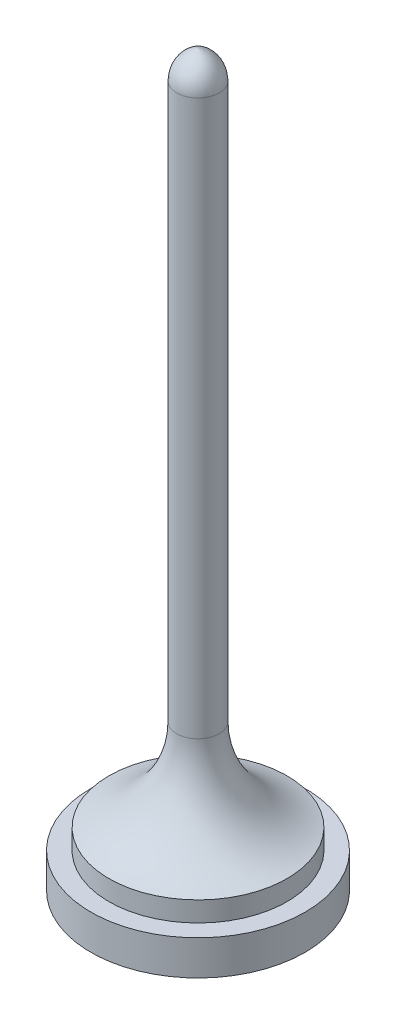
from build123d import *


with BuildPart() as part:
    # Sketch1 → Revolve1 (revolve)
    with BuildSketch(Plane.XY):
        with BuildLine():
            Line((0, 0), (-16.6, 0))
            Line((-16.6, 0), (-16.6, 5.4))
            Line((-16.6, 5.4), (-13.8, 5.4))
            Line((-13.8, 5.4), (-13.8, 8.5))
            ThreePointArc((-13.8, 8.5), (-6.200683561, 13.851231998), (-3.285, 22.676427952))
            Line((-3.285, 22.676427952), (-3.285, 108.660056657))
            ThreePointArc((-3.285, 108.660056657), (-2.371150985, 111.381560525), (0, 113))
            Line((0, 113), (0, 0))
        make_face()
    revolve(axis=Axis((0, 113, 0), (0, -1, 0)))


solid = part.part
